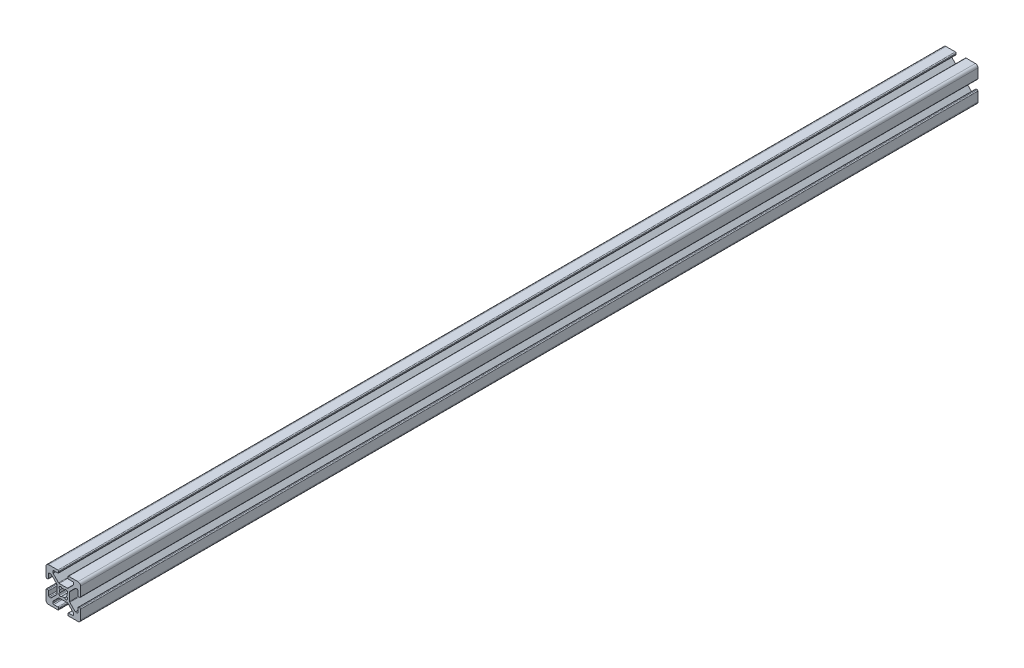
from build123d import *

# Parameters (mm, degrees)
EXTRUDE1_DEPTH = 520


with BuildPart() as part:
    # Sketch1 → Extrude1 (new body)
    with BuildSketch(Plane.XY):
        with BuildLine():
            Line((-5.032287798, -0.341059771), (-5.516287798, -0.341059771))
            ThreePointArc((-5.516287798, -0.341059771), (-5.875498042, -0.192270016), (-6.024287798, 0.166940229))
            Line((-6.024287798, 0.166940229), (-6.024287798, 2.515940229))
            ThreePointArc((-6.024287798, 2.515940229), (-6.173077553, 2.875150474), (-6.532287798, 3.023940229))
            Line((-6.532287798, 3.023940229), (-7.258207136, 3.023940229))
            ThreePointArc((-7.258207136, 3.023940229), (-7.45261032, 2.985271032), (-7.617417381, 2.875150474))
            Line((-7.617417381, 2.875150474), (-10.720498042, -0.227930187))
            ThreePointArc((-10.720498042, -0.227930187), (-10.8306186, -0.392737249), (-10.869287798, -0.587140432))
            Line((-10.869287798, -0.587140432), (-10.869287798, -5.354979109))
            ThreePointArc((-10.869287798, -5.354979109), (-10.8306186, -5.549382293), (-10.720498042, -5.714189354))
            Line((-10.720498042, -5.714189354), (-7.617417381, -8.817270016))
            ThreePointArc((-7.617417381, -8.817270016), (-7.45261032, -8.927390573), (-7.258207136, -8.966059771))
            Line((-7.258207136, -8.966059771), (-6.532287798, -8.966059771))
            ThreePointArc((-6.532287798, -8.966059771), (-6.173077553, -8.817270016), (-6.024287798, -8.458059771))
            Line((-6.024287798, -8.458059771), (-6.024287798, -6.109059771))
            ThreePointArc((-6.024287798, -6.109059771), (-5.875498042, -5.749849526), (-5.516287798, -5.601059771))
            Line((-5.516287798, -5.601059771), (-5.032287798, -5.601059771))
            ThreePointArc((-5.032287798, -5.601059771), (-4.673077553, -5.749849526), (-4.524287798, -6.109059771))
            Line((-4.524287798, -6.109059771), (-4.524287798, -11.471059771))
            ThreePointArc((-4.524287798, -11.471059771), (-4.963627626, -12.531719943), (-6.024287798, -12.971059771))
            Line((-6.024287798, -12.971059771), (-11.386287798, -12.971059771))
            ThreePointArc((-11.386287798, -12.971059771), (-11.745498042, -12.822270016), (-11.894287798, -12.463059771))
            Line((-11.894287798, -12.463059771), (-11.894287798, -11.979059771))
            ThreePointArc((-11.894287798, -11.979059771), (-11.745498042, -11.619849526), (-11.386287798, -11.471059771))
            Line((-11.386287798, -11.471059771), (-9.037287798, -11.471059771))
            ThreePointArc((-9.037287798, -11.471059771), (-8.678077553, -11.322270016), (-8.529287798, -10.963059771))
            Line((-8.529287798, -10.963059771), (-8.529287798, -10.237140432))
            ThreePointArc((-8.529287798, -10.237140432), (-8.567956995, -10.042737249), (-8.678077553, -9.877930187))
            Line((-8.678077553, -9.877930187), (-11.781158214, -6.774849526))
            ThreePointArc((-11.781158214, -6.774849526), (-11.945965275, -6.664728968), (-12.140368459, -6.626059771))
            Line((-12.140368459, -6.626059771), (-16.908207136, -6.626059771))
            ThreePointArc((-16.908207136, -6.626059771), (-17.10261032, -6.664728968), (-17.267417381, -6.774849526))
            Line((-17.267417381, -6.774849526), (-20.370498042, -9.877930187))
            ThreePointArc((-20.370498042, -9.877930187), (-20.4806186, -10.042737249), (-20.519287798, -10.237140432))
            Line((-20.519287798, -10.237140432), (-20.519287798, -10.963059771))
            ThreePointArc((-20.519287798, -10.963059771), (-20.370498042, -11.322270016), (-20.011287798, -11.471059771))
            Line((-20.011287798, -11.471059771), (-17.662287798, -11.471059771))
            ThreePointArc((-17.662287798, -11.471059771), (-17.303077553, -11.619849526), (-17.154287798, -11.979059771))
            Line((-17.154287798, -11.979059771), (-17.154287798, -12.463059771))
            ThreePointArc((-17.154287798, -12.463059771), (-17.303077553, -12.822270016), (-17.662287798, -12.971059771))
            Line((-17.662287798, -12.971059771), (-23.024287798, -12.971059771))
            ThreePointArc((-23.024287798, -12.971059771), (-24.084947969, -12.531719943), (-24.524287798, -11.471059771))
            Line((-24.524287798, -11.471059771), (-24.524287798, -6.109059771))
            ThreePointArc((-24.524287798, -6.109059771), (-24.375498042, -5.749849526), (-24.016287798, -5.601059771))
            Line((-24.016287798, -5.601059771), (-23.532287798, -5.601059771))
            ThreePointArc((-23.532287798, -5.601059771), (-23.173077553, -5.749849526), (-23.024287798, -6.109059771))
            Line((-23.024287798, -6.109059771), (-23.024287798, -8.458059771))
            ThreePointArc((-23.024287798, -8.458059771), (-22.875498042, -8.817270016), (-22.516287798, -8.966059771))
            Line((-22.516287798, -8.966059771), (-21.790368459, -8.966059771))
            ThreePointArc((-21.790368459, -8.966059771), (-21.595965275, -8.927390573), (-21.431158214, -8.817270016))
            Line((-21.431158214, -8.817270016), (-18.328077553, -5.714189354))
            ThreePointArc((-18.328077553, -5.714189354), (-18.217956995, -5.549382293), (-18.179287798, -5.354979109))
            Line((-18.179287798, -5.354979109), (-18.179287798, -0.587140432))
            ThreePointArc((-18.179287798, -0.587140432), (-18.217956995, -0.392737249), (-18.328077553, -0.227930187))
            Line((-18.328077553, -0.227930187), (-21.431158214, 2.875150474))
            ThreePointArc((-21.431158214, 2.875150474), (-21.595965275, 2.985271032), (-21.790368459, 3.023940229))
            Line((-21.790368459, 3.023940229), (-22.516287798, 3.023940229))
            ThreePointArc((-22.516287798, 3.023940229), (-22.875498042, 2.875150474), (-23.024287798, 2.515940229))
            Line((-23.024287798, 2.515940229), (-23.024287798, 0.166940229))
            ThreePointArc((-23.024287798, 0.166940229), (-23.173077553, -0.192270016), (-23.532287798, -0.341059771))
            Line((-23.532287798, -0.341059771), (-24.016287798, -0.341059771))
            ThreePointArc((-24.016287798, -0.341059771), (-24.375498042, -0.192270016), (-24.524287798, 0.166940229))
            Line((-24.524287798, 0.166940229), (-24.524287798, 5.528940229))
            ThreePointArc((-24.524287798, 5.528940229), (-24.084947969, 6.589600401), (-23.024287798, 7.028940229))
            Line((-23.024287798, 7.028940229), (-17.662287798, 7.028940229))
            ThreePointArc((-17.662287798, 7.028940229), (-17.303077553, 6.880150474), (-17.154287798, 6.520940229))
            Line((-17.154287798, 6.520940229), (-17.154287798, 6.036940229))
            ThreePointArc((-17.154287798, 6.036940229), (-17.303077553, 5.677729984), (-17.662287798, 5.528940229))
            Line((-17.662287798, 5.528940229), (-20.011287798, 5.528940229))
            ThreePointArc((-20.011287798, 5.528940229), (-20.370498042, 5.380150474), (-20.519287798, 5.020940229))
            Line((-20.519287798, 5.020940229), (-20.519287798, 4.295020891))
            ThreePointArc((-20.519287798, 4.295020891), (-20.4806186, 4.100617707), (-20.370498042, 3.935810646))
            Line((-20.370498042, 3.935810646), (-17.267417381, 0.832729984))
            ThreePointArc((-17.267417381, 0.832729984), (-17.10261032, 0.722609427), (-16.908207136, 0.683940229))
            Line((-16.908207136, 0.683940229), (-12.140368459, 0.683940229))
            ThreePointArc((-12.140368459, 0.683940229), (-11.945965275, 0.722609427), (-11.781158214, 0.832729984))
            Line((-11.781158214, 0.832729984), (-8.678077553, 3.935810646))
            ThreePointArc((-8.678077553, 3.935810646), (-8.567956995, 4.100617707), (-8.529287798, 4.295020891))
            Line((-8.529287798, 4.295020891), (-8.529287798, 5.020940229))
            ThreePointArc((-8.529287798, 5.020940229), (-8.678077553, 5.380150474), (-9.037287798, 5.528940229))
            Line((-9.037287798, 5.528940229), (-11.386287798, 5.528940229))
            ThreePointArc((-11.386287798, 5.528940229), (-11.745498042, 5.677729984), (-11.894287798, 6.036940229))
            Line((-11.894287798, 6.036940229), (-11.894287798, 6.520940229))
            ThreePointArc((-11.894287798, 6.520940229), (-11.745498042, 6.880150474), (-11.386287798, 7.028940229))
            Line((-11.386287798, 7.028940229), (-6.024287798, 7.028940229))
            ThreePointArc((-6.024287798, 7.028940229), (-4.963627626, 6.589600401), (-4.524287798, 5.528940229))
            Line((-4.524287798, 5.528940229), (-4.524287798, 0.166940229))
            ThreePointArc((-4.524287798, 0.166940229), (-4.673077553, -0.192270016), (-5.032287798, -0.341059771))
        make_face()
        with BuildLine():
            Line((-12.399386954, -5.275565737), (-12.219781831, -5.095960615))
            ThreePointArc((-12.219781831, -5.095960615), (-12.018349781, -4.327527582), (-12.589154291, -3.775036489))
            ThreePointArc((-12.589154291, -3.775036489), (-12.428787798, -2.971059771), (-12.589154291, -2.167083053))
            ThreePointArc((-12.589154291, -2.167083053), (-12.018349781, -1.61459196), (-12.219781831, -0.846158927))
            Line((-12.219781831, -0.846158927), (-12.399386954, -0.666553805))
            ThreePointArc((-12.399386954, -0.666553805), (-13.167819987, -0.465121754), (-13.72031108, -1.035926265))
            ThreePointArc((-13.72031108, -1.035926265), (-14.524287798, -0.875559771), (-15.328264516, -1.035926265))
            ThreePointArc((-15.328264516, -1.035926265), (-15.880755608, -0.465121754), (-16.649188641, -0.666553805))
            Line((-16.649188641, -0.666553805), (-16.828793764, -0.846158927))
            ThreePointArc((-16.828793764, -0.846158927), (-17.030225814, -1.61459196), (-16.459421304, -2.167083053))
            ThreePointArc((-16.459421304, -2.167083053), (-16.619787798, -2.971059771), (-16.459421304, -3.775036489))
            ThreePointArc((-16.459421304, -3.775036489), (-17.030225814, -4.327527582), (-16.828793764, -5.095960615))
            Line((-16.828793764, -5.095960615), (-16.649188641, -5.275565737))
            ThreePointArc((-16.649188641, -5.275565737), (-15.880755608, -5.476997788), (-15.328264516, -4.906193277))
            ThreePointArc((-15.328264516, -4.906193277), (-14.524287798, -5.066559771), (-13.72031108, -4.906193277))
            ThreePointArc((-13.72031108, -4.906193277), (-13.167819987, -5.476997788), (-12.399386954, -5.275565737))
        make_face(mode=Mode.SUBTRACT)
    extrude(amount=EXTRUDE1_DEPTH)


solid = part.part
